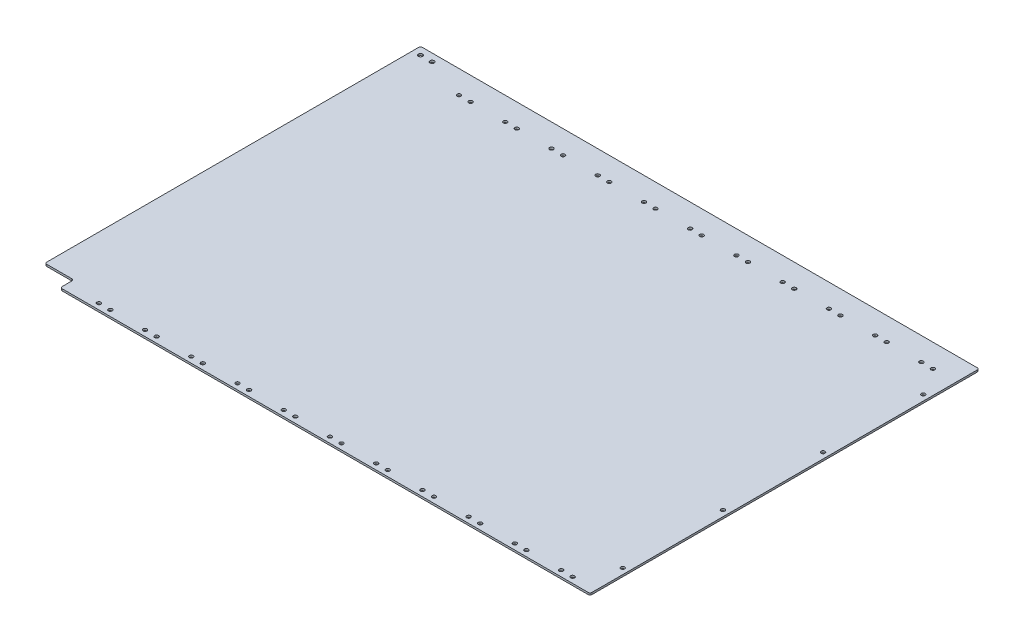
from build123d import *

# Parameters (mm, degrees)
SKETCH1_W           = 920.75
SKETCH1_H           = 641.35
BOSS_EXTRUDE1_DEPTH = 3.175
SKETCH2_R           = 3.429
SKETCH2_R_2         = 3.175
SKETCH2_W           = 47.625
SKETCH2_H           = 22.225
CUT_EXTRUDE1_DEPTH  = 3.175
FILLET1_R           = 3.175


with BuildPart() as part:
    # Sketch1 → Boss-Extrude1 (new body)
    with BuildSketch(Plane(origin=(0, 0, 0), x_dir=(1, 0, 0), z_dir=(0, 1, 0))):
        with Locations((460.375, 320.675)):
            Rectangle(SKETCH1_W, SKETCH1_H)
    extrude(amount=BOSS_EXTRUDE1_DEPTH)

    # Sketch2 → Cut-Extrude1 (cut)
    with BuildSketch(Plane(origin=(0, 3.175, 0), x_dir=(1, 0, 0), z_dir=(0, 1, 0))):
        with Locations(Location((12.7, 628.65, 0), (0, 0, 270))):
            Circle(SKETCH2_R)
        with Locations(Location((31.75, 628.65, 0), (0, 0, 270))):
            Circle(SKETCH2_R)
        with Locations(Location((101.6, 9.525, 0), (0, 0, 270))):
            Circle(SKETCH2_R_2)
        with Locations(Location((120.65, 9.525, 0), (0, 0, 270))):
            Circle(SKETCH2_R_2)
        with Locations(Location((196.85, 9.525, 0), (0, 0, 270))):
            Circle(SKETCH2_R_2)
        with Locations(Location((177.8, 9.525, 0), (0, 0, 270))):
            Circle(SKETCH2_R_2)
        with Locations(Location((273.05, 9.525, 0), (0, 0, 270))):
            Circle(SKETCH2_R_2)
        with Locations(Location((254, 9.525, 0), (0, 0, 270))):
            Circle(SKETCH2_R_2)
        with Locations(Location((349.25, 9.525, 0), (0, 0, 270))):
            Circle(SKETCH2_R_2)
        with Locations(Location((330.2, 9.525, 0), (0, 0, 270))):
            Circle(SKETCH2_R_2)
        with Locations(Location((425.45, 9.525, 0), (0, 0, 270))):
            Circle(SKETCH2_R_2)
        with Locations(Location((406.4, 9.525, 0), (0, 0, 270))):
            Circle(SKETCH2_R_2)
        with Locations(Location((501.65, 9.525, 0), (0, 0, 270))):
            Circle(SKETCH2_R_2)
        with Locations(Location((482.6, 9.525, 0), (0, 0, 270))):
            Circle(SKETCH2_R_2)
        with Locations(Location((577.85, 9.525, 0), (0, 0, 270))):
            Circle(SKETCH2_R_2)
        with Locations(Location((558.8, 9.525, 0), (0, 0, 270))):
            Circle(SKETCH2_R_2)
        with Locations(Location((654.05, 9.525, 0), (0, 0, 270))):
            Circle(SKETCH2_R_2)
        with Locations(Location((635, 9.525, 0), (0, 0, 270))):
            Circle(SKETCH2_R_2)
        with Locations(Location((730.25, 9.525, 0), (0, 0, 270))):
            Circle(SKETCH2_R_2)
        with Locations(Location((711.2, 9.525, 0), (0, 0, 270))):
            Circle(SKETCH2_R_2)
        with Locations(Location((806.45, 9.525, 0), (0, 0, 270))):
            Circle(SKETCH2_R_2)
        with Locations(Location((787.4, 9.525, 0), (0, 0, 270))):
            Circle(SKETCH2_R_2)
        with Locations(Location((882.65, 9.525, 0), (0, 0, 270))):
            Circle(SKETCH2_R_2)
        with Locations(Location((863.6, 9.525, 0), (0, 0, 270))):
            Circle(SKETCH2_R_2)
        with Locations(Location((882.65, 603.25, 0), (0, 0, 270))):
            Circle(SKETCH2_R_2)
        with Locations(Location((863.6, 603.25, 0), (0, 0, 270))):
            Circle(SKETCH2_R_2)
        with Locations(Location((806.45, 603.25, 0), (0, 0, 270))):
            Circle(SKETCH2_R_2)
        with Locations(Location((787.4, 603.25, 0), (0, 0, 270))):
            Circle(SKETCH2_R_2)
        with Locations(Location((730.25, 603.25, 0), (0, 0, 270))):
            Circle(SKETCH2_R_2)
        with Locations(Location((711.2, 603.25, 0), (0, 0, 270))):
            Circle(SKETCH2_R_2)
        with Locations(Location((635, 603.25, 0), (0, 0, 270))):
            Circle(SKETCH2_R_2)
        with Locations(Location((654.05, 603.25, 0), (0, 0, 270))):
            Circle(SKETCH2_R_2)
        with Locations(Location((482.6, 603.25, 0), (0, 0, 270))):
            Circle(SKETCH2_R_2)
        with Locations(Location((501.65, 603.25, 0), (0, 0, 270))):
            Circle(SKETCH2_R_2)
        with Locations(Location((558.8, 603.25, 0), (0, 0, 270))):
            Circle(SKETCH2_R_2)
        with Locations(Location((577.85, 603.25, 0), (0, 0, 270))):
            Circle(SKETCH2_R_2)
        with Locations(Location((425.45, 603.25, 0), (0, 0, 270))):
            Circle(SKETCH2_R_2)
        with Locations(Location((406.4, 603.25, 0), (0, 0, 270))):
            Circle(SKETCH2_R_2)
        with Locations(Location((120.65, 603.25, 0), (0, 0, 270))):
            Circle(SKETCH2_R_2)
        with Locations(Location((177.8, 603.25, 0), (0, 0, 270))):
            Circle(SKETCH2_R_2)
        with Locations(Location((196.85, 603.25, 0), (0, 0, 270))):
            Circle(SKETCH2_R_2)
        with Locations(Location((254, 603.25, 0), (0, 0, 270))):
            Circle(SKETCH2_R_2)
        with Locations(Location((273.05, 603.25, 0), (0, 0, 270))):
            Circle(SKETCH2_R_2)
        with Locations(Location((330.2, 603.25, 0), (0, 0, 270))):
            Circle(SKETCH2_R_2)
        with Locations(Location((349.25, 603.25, 0), (0, 0, 270))):
            Circle(SKETCH2_R_2)
        with Locations(Location((101.6, 603.25, 0), (0, 0, 270))):
            Circle(SKETCH2_R_2)
        with Locations(Location((911.225, 63.5, 0), (0, 0, 270))):
            Circle(SKETCH2_R_2)
        with Locations(Location((911.225, 228.6, 0), (0, 0, 270))):
            Circle(SKETCH2_R_2)
        with Locations(Location((911.225, 393.7, 0), (0, 0, 270))):
            Circle(SKETCH2_R_2)
        with Locations(Location((911.225, 558.8, 0), (0, 0, 270))):
            Circle(SKETCH2_R_2)
        with Locations((23.8125, 11.1125)):
            Rectangle(SKETCH2_W, SKETCH2_H)
    extrude(amount=-CUT_EXTRUDE1_DEPTH, mode=Mode.SUBTRACT)

    # Fillet1
    fillet1_edges = [part.edges().sort_by_distance(p)[0] for p in [
        (0, 1.5875, -22.225),
        (47.625, 1.5875, -22.225),
        (47.625, 1.5875, 0),
        (0, 1.5875, -641.35),
        (920.75, 1.5875, -641.35),
        (920.75, 1.5875, 0),
    ]]
    fillet(fillet1_edges, radius=FILLET1_R)


solid = part.part
